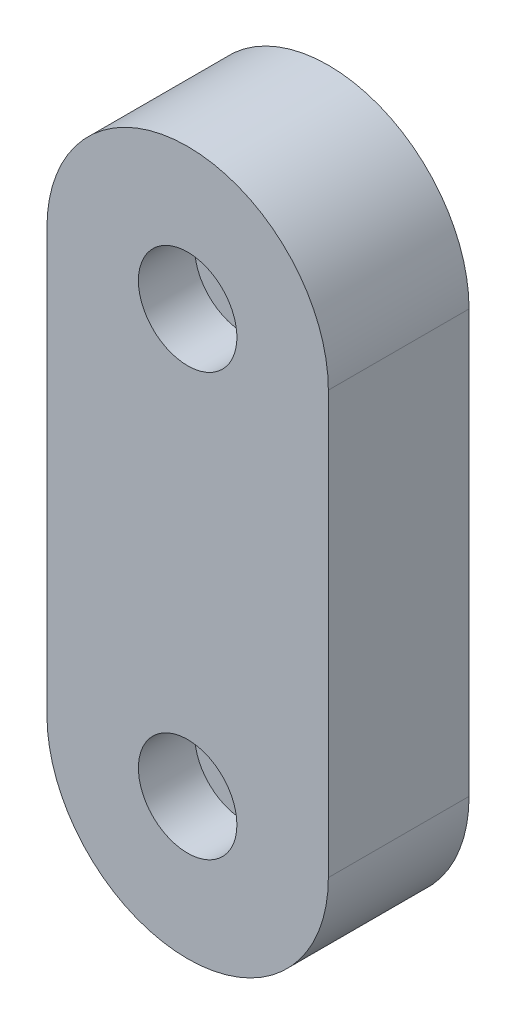
from build123d import *

# Parameters (mm, degrees)
BOSS_EXTRUDE1_DEPTH = 10
SKETCH3_R           = 3.5
CUT_EXTRUDE1_DEPTH  = 4
SKETCH4_R           = 1.55
CUT_EXTRUDE2_DEPTH  = 22


with BuildPart() as part:
    # Sketch1 → Boss-Extrude1 (new body)
    with BuildSketch(Plane.XY):
        with BuildLine():
            Line((-10, 0), (-10, 30))
            ThreePointArc((-10, 30), (0, 40), (10, 30))
            Line((10, 30), (10, 0))
            ThreePointArc((10, 0), (0, -10), (-10, 0))
        make_face()
    extrude(amount=BOSS_EXTRUDE1_DEPTH)

    # Sketch3 → Cut-Extrude1 (cut)
    with BuildSketch(Plane.XY.offset(10)):
        Circle(SKETCH3_R)
        with Locations(Location((0, 30, 0), (0, 0, 180))):
            Circle(SKETCH3_R)
    extrude(amount=-CUT_EXTRUDE1_DEPTH, mode=Mode.SUBTRACT)

    # Sketch4 → Cut-Extrude2 (cut)
    with BuildSketch(Plane.XY.offset(6)):
        Circle(SKETCH4_R)
        with Locations((0, 30)):
            Circle(SKETCH4_R)
    extrude(amount=-CUT_EXTRUDE2_DEPTH, mode=Mode.SUBTRACT)


solid = part.part
